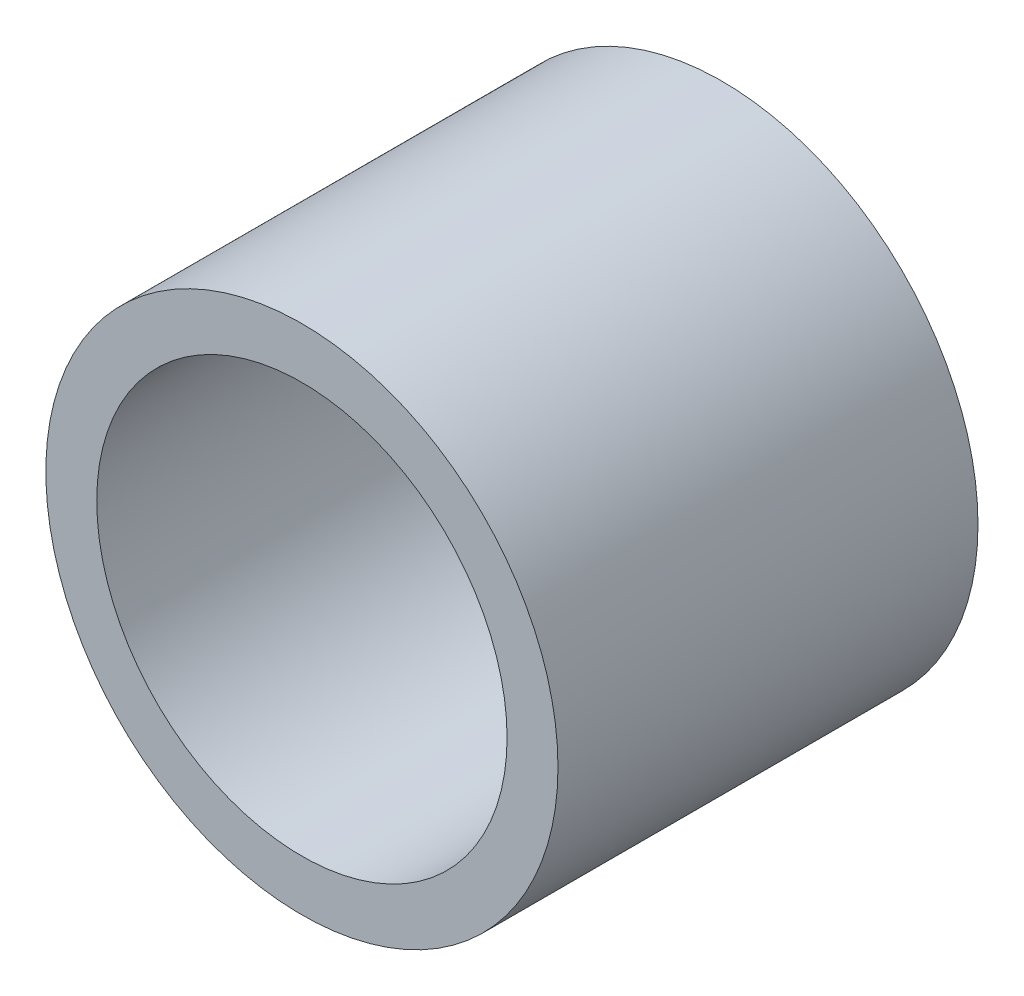
from build123d import *

# Parameters (mm, degrees)
SKETCH1_R           = 5.03
SKETCH1_R_2         = 4.03
EXTRUDE_THIN1_DEPTH = 8.25


with BuildPart() as part:
    # Sketch1 → Extrude-Thin1 (new body)
    with BuildSketch(Plane.XY):
        Circle(SKETCH1_R)
        Circle(SKETCH1_R_2, mode=Mode.SUBTRACT)
    extrude(amount=EXTRUDE_THIN1_DEPTH)


solid = part.part
